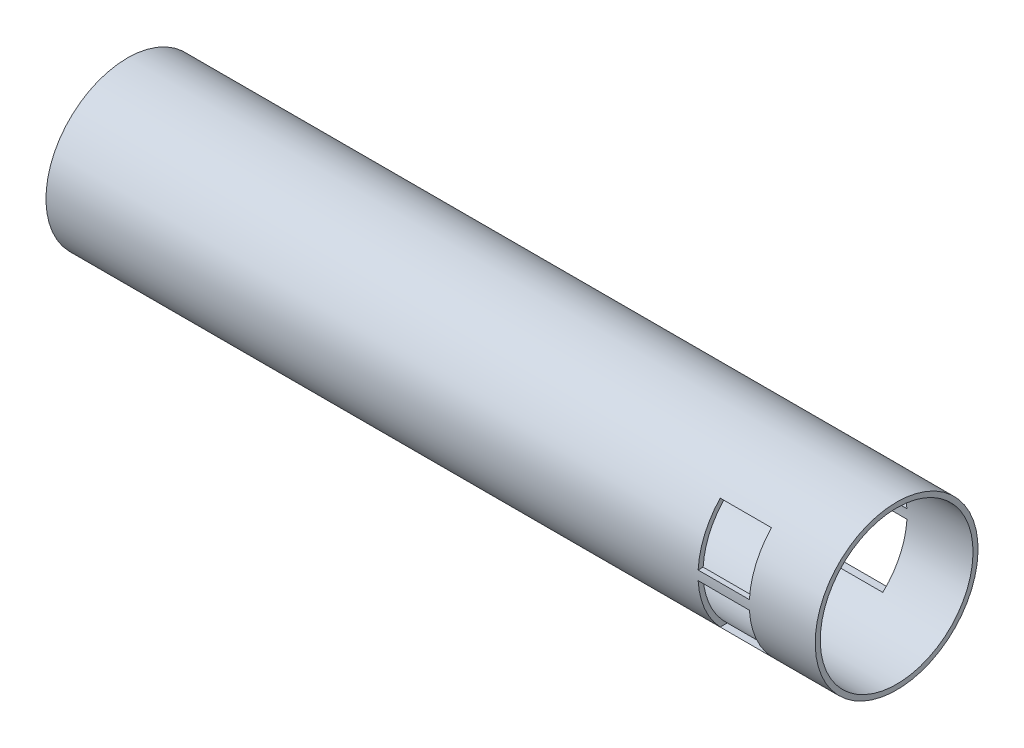
from build123d import *

# Parameters (mm, degrees)
SKETCH12_R              = 44.45
SKETCH12_R_2            = 41.7068
PIPE_0_5_SCH_40_1_DEPTH = 420
CUT_EXTRUDE1_DEPTH      = 50
CUT_EXTRUDE1_DEPTH_BACK = 50
SKETCH13_W              = 28
SKETCH13_H              = 28


with BuildPart() as part:
    # Sketch12 → Pipe 0.5 SCH 40(1) (new body)
    with BuildSketch(Plane.YZ.offset(-210)):
        Circle(SKETCH12_R)
        Circle(SKETCH12_R_2, mode=Mode.SUBTRACT)
    extrude(amount=PIPE_0_5_SCH_40_1_DEPTH)

    # Sketch13 → Cut-Extrude1 (cut, two sides: drawn at the far end of the back side and taken through both)
    with BuildSketch(Plane.XY.offset(-CUT_EXTRUDE1_DEPTH_BACK)):
        with Locations((160, 16.5)):
            Rectangle(SKETCH13_W, SKETCH13_H)
        with Locations((160, -16.5)):
            Rectangle(SKETCH13_W, SKETCH13_H)
    extrude(amount=CUT_EXTRUDE1_DEPTH + CUT_EXTRUDE1_DEPTH_BACK, mode=Mode.SUBTRACT)


solid = part.part
